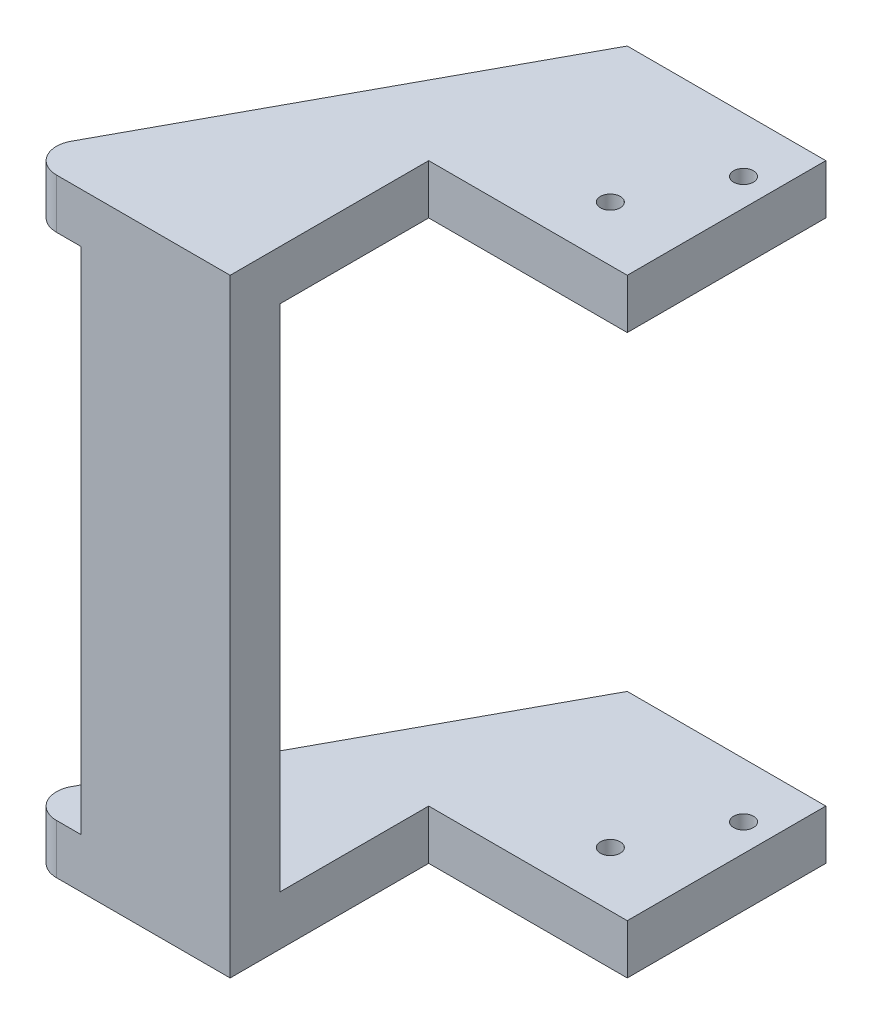
from build123d import *

# Parameters (mm, degrees)
SKETCH_1_W          = 40
SKETCH_1_H          = 61.3
EXTRUDE_1_DEPTH     = 40
SKETCH_2_W          = 20
SKETCH_2_H          = 51.3
CUT_EXTRUDE_1_DEPTH = 55.216441233
SKETCH_3_W          = 5
SKETCH_3_H          = 51.3
CUT_EXTRUDE_2_DEPTH = 55.216441233
SKETCH_4_W          = 35
SKETCH_4_H          = 51.3
CUT_EXTRUDE_3_DEPTH = 55.216441233
SKETCH_5_W          = 20
SKETCH_5_H          = 20
CUT_EXTRUDE_5_DEPTH = 76.879443857
SKETCH_6_R          = 1
CUT_EXTRUDE_6_DEPTH = 76.879443857


with BuildPart() as part:
    # 草图1 → 凸台-拉伸1 (new body)
    with BuildSketch(Plane.XY):
        Rectangle(SKETCH_1_W, SKETCH_1_H)
    extrude(amount=EXTRUDE_1_DEPTH)

    # 草图2 → 切除-拉伸1 (cut, through all)
    with BuildSketch(Plane.XY.offset(40)):
        with Locations((10, 0)):
            Rectangle(SKETCH_2_W, SKETCH_2_H)
    extrude(amount=-CUT_EXTRUDE_1_DEPTH, mode=Mode.SUBTRACT)

    # 草图3 → 切除-拉伸2 (cut, through all)
    with BuildSketch(Plane.XY.offset(40)):
        with Locations((-17.5, 0)):
            Rectangle(SKETCH_3_W, SKETCH_3_H)
    extrude(amount=-CUT_EXTRUDE_2_DEPTH, mode=Mode.SUBTRACT)

    # 草图4 → 切除-拉伸3 (cut, through all)
    with BuildSketch(Plane(origin=(0, 0, 0), x_dir=(0, 0, -1), z_dir=(1, 0, 0))):
        with Locations((-17.5, 0)):
            Rectangle(SKETCH_4_W, SKETCH_4_H)
    extrude(amount=-CUT_EXTRUDE_3_DEPTH, mode=Mode.SUBTRACT)

    # 草图5 → 切除-拉伸5 (cut, through all)
    with BuildSketch(Plane.XZ.offset(30.65)):
        with BuildLine():
            ThreePointArc((-19.697451431, 36.307856046), (-19.923182678, 36.885031943), (-20, 37.5))
            Line((-20, 37.5), (-20, 36.865536816))
            Line((-20, 36.865536816), (-19.697451431, 36.307856046))
        make_face()
        with BuildLine():
            ThreePointArc((-20, 37.5), (-19.267766953, 39.267766953), (-17.5, 40))
            Line((-17.5, 40), (-20, 40))
            Line((-20, 40), (-20, 37.5))
        make_face()
        Polygon((0, 0), (-19.697451431, 36.307856046), (-20, 36.865536816), (-20, 0), align=None)
        with Locations((10, 30)):
            Rectangle(SKETCH_5_W, SKETCH_5_H)
    extrude(amount=-CUT_EXTRUDE_5_DEPTH, mode=Mode.SUBTRACT)

    # 草图6 → 切除-拉伸6 (cut, through all)
    with BuildSketch(Plane.XZ.offset(30.65)):
        with Locations(Location((12.765, 14.47, 0), (0, 0, 270))):
            Circle(SKETCH_6_R)
        with Locations(Location((17.237135955, 5.52572809, 0), (0, 0, 270))):
            Circle(SKETCH_6_R)
    extrude(amount=-CUT_EXTRUDE_6_DEPTH, mode=Mode.SUBTRACT)


solid = part.part
